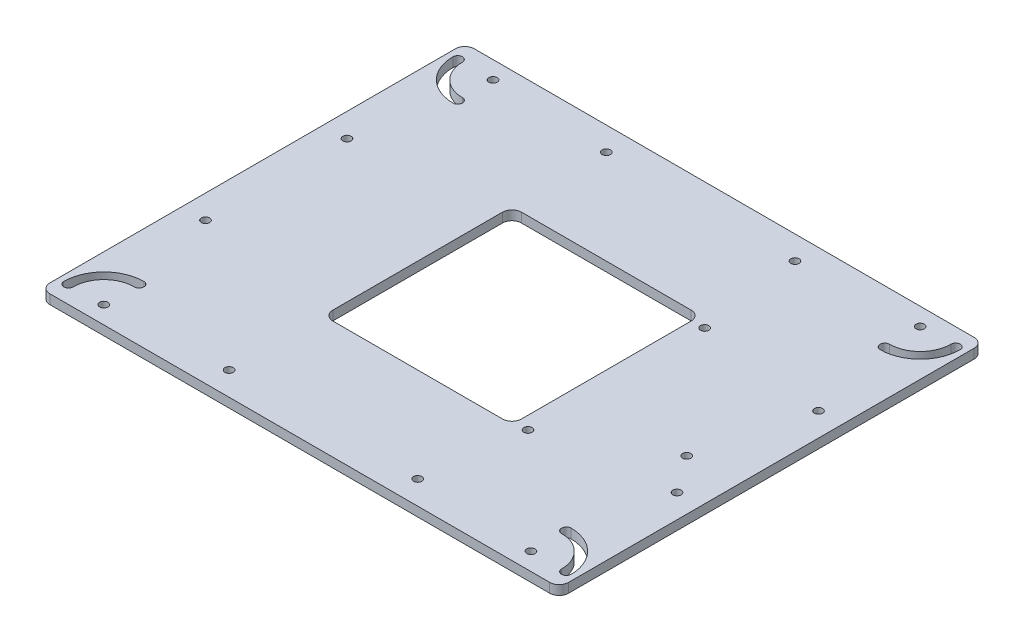
from build123d import *

# Parameters (mm, degrees)
SKETCH_1_W          = 220
SKETCH_1_H          = 180
EXTRUDE_1_DEPTH     = 4
SKETCH_2_W          = 80
SKETCH_2_H          = 80
CUT_EXTRUDE_1_DEPTH = 4
SKETCH_3_R          = 1.75
CUT_EXTRUDE_2_DEPTH = 4
SKETCH_5_R          = 1.75
CUT_EXTRUDE_3_DEPTH = 4
SKETCH_6_R          = 1.75
CUT_EXTRUDE_4_DEPTH = 4
FILLET_1_R          = 4
FILLET_2_R          = 4


with BuildPart() as part:
    # 草图1 → 凸台-拉伸1 (new body)
    with BuildSketch(Plane(origin=(0, 0, 0), x_dir=(1, 0, 0), z_dir=(0, 1, 0))):
        Rectangle(SKETCH_1_W, SKETCH_1_H)
    extrude(amount=EXTRUDE_1_DEPTH)

    # 草图2 → 切除-拉伸1 (cut)
    with BuildSketch(Plane(origin=(0, 4, 0), x_dir=(1, 0, 0), z_dir=(0, 1, 0))):
        Rectangle(SKETCH_2_W, SKETCH_2_H)
    extrude(amount=-CUT_EXTRUDE_1_DEPTH, mode=Mode.SUBTRACT)

    # 草图3 → 切除-拉伸2 (cut)
    with BuildSketch(Plane(origin=(0, 0, 0), x_dir=(-1, 0, 0), z_dir=(0, -1, 0))):
        with BuildLine():
            ThreePointArc((90.584745347, 69.545196968), (99.777133502, 73.352808813), (103.584745347, 82.545196968))
            ThreePointArc((103.584745347, 82.545196968), (105.584745347, 84.545196968), (107.584745347, 82.545196968))
            ThreePointArc((107.584745347, 82.545196968), (102.605560627, 70.524381688), (90.584745347, 65.545196968))
            ThreePointArc((90.584745347, 65.545196968), (88.584745347, 67.545196968), (90.584745347, 69.545196968))
        make_face()
        with Locations(Location((90.584745347, 82.545196968, 0), (0, 0, 90))):
            Circle(SKETCH_3_R)
        with BuildLine():
            ThreePointArc((-90.584745347, -69.545196968), (-99.777133502, -73.352808813), (-103.584745347, -82.545196968))
            ThreePointArc((-103.584745347, -82.545196968), (-105.584745347, -84.545196968), (-107.584745347, -82.545196968))
            ThreePointArc((-107.584745347, -82.545196968), (-102.605560627, -70.524381688), (-90.584745347, -65.545196968))
            ThreePointArc((-90.584745347, -65.545196968), (-88.584745347, -67.545196968), (-90.584745347, -69.545196968))
        make_face()
        with Locations(Location((-90.584745347, -82.545196968, 0), (0, 0, 90))):
            Circle(SKETCH_3_R)
        with BuildLine():
            ThreePointArc((-90.584745347, 65.545196968), (-102.605560627, 70.524381688), (-107.584745347, 82.545196968))
            ThreePointArc((-107.584745347, 82.545196968), (-105.584745347, 84.545196968), (-103.584745347, 82.545196968))
            ThreePointArc((-103.584745347, 82.545196968), (-99.777133502, 73.352808813), (-90.584745347, 69.545196968))
            ThreePointArc((-90.584745347, 69.545196968), (-88.584745347, 67.545196968), (-90.584745347, 65.545196968))
        make_face()
        with Locations(Location((-90.584745347, 82.545196968, 0), (0, 0, 90))):
            Circle(SKETCH_3_R)
        with BuildLine():
            ThreePointArc((90.584745347, -69.545196968), (99.777133502, -73.352808813), (103.584745347, -82.545196968))
            ThreePointArc((103.584745347, -82.545196968), (105.584745347, -84.545196968), (107.584745347, -82.545196968))
            ThreePointArc((107.584745347, -82.545196968), (102.605560627, -70.524381688), (90.584745347, -65.545196968))
            ThreePointArc((90.584745347, -65.545196968), (88.584745347, -67.545196968), (90.584745347, -69.545196968))
        make_face()
        with Locations(Location((90.584745347, -82.545196968, 0), (0, 0, 90))):
            Circle(SKETCH_3_R)
    extrude(amount=-CUT_EXTRUDE_2_DEPTH, mode=Mode.SUBTRACT)

    # 草图5 → 切除-拉伸3 (cut)
    with BuildSketch(Plane.XZ):
        with Locations(Location((45.401224127, 38.626328315, 0), (0, 0, 270))):
            Circle(SKETCH_5_R)
        with Locations(Location((88.581224127, 14.496328315, 0), (0, 0, 270))):
            Circle(SKETCH_5_R)
        with Locations(Location((45.401224127, -36.303671685, 0), (0, 0, 270))):
            Circle(SKETCH_5_R)
    extrude(amount=-CUT_EXTRUDE_3_DEPTH, mode=Mode.SUBTRACT)

    # 草图6 → 切除-拉伸4 (cut)
    with BuildSketch(Plane.XZ):
        with Locations(Location((-40, -80, 0), (0, 0, 270))):
            Circle(SKETCH_6_R)
        with Locations(Location((-100, -30, 0), (0, 0, 270))):
            Circle(SKETCH_6_R)
        with Locations(Location((40, -80, 0), (0, 0, 90))):
            Circle(SKETCH_6_R)
        with Locations(Location((100, -30, 0), (0, 0, 90))):
            Circle(SKETCH_6_R)
        with Locations(Location((100, 30, 0), (0, 0, 270))):
            Circle(SKETCH_6_R)
        with Locations(Location((40, 80, 0), (0, 0, 270))):
            Circle(SKETCH_6_R)
        with Locations(Location((-40, 80, 0), (0, 0, 90))):
            Circle(SKETCH_6_R)
        with Locations(Location((-100, 30, 0), (0, 0, 90))):
            Circle(SKETCH_6_R)
    extrude(amount=-CUT_EXTRUDE_4_DEPTH, mode=Mode.SUBTRACT)

    # 圆角1
    fillet_1_edges = [part.edges().sort_by_distance(p)[0] for p in [
        (110, 2, 90),
        (-110, 2, 90),
        (-110, 2, -90),
        (110, 2, -90),
    ]]
    fillet(fillet_1_edges, radius=FILLET_1_R)

    # 圆角2
    fillet_2_edges = [part.edges().sort_by_distance(p)[0] for p in [
        (-40, 2, -40),
        (40, 2, -40),
        (40, 2, 40),
        (-40, 2, 40),
    ]]
    fillet(fillet_2_edges, radius=FILLET_2_R)


solid = part.part
